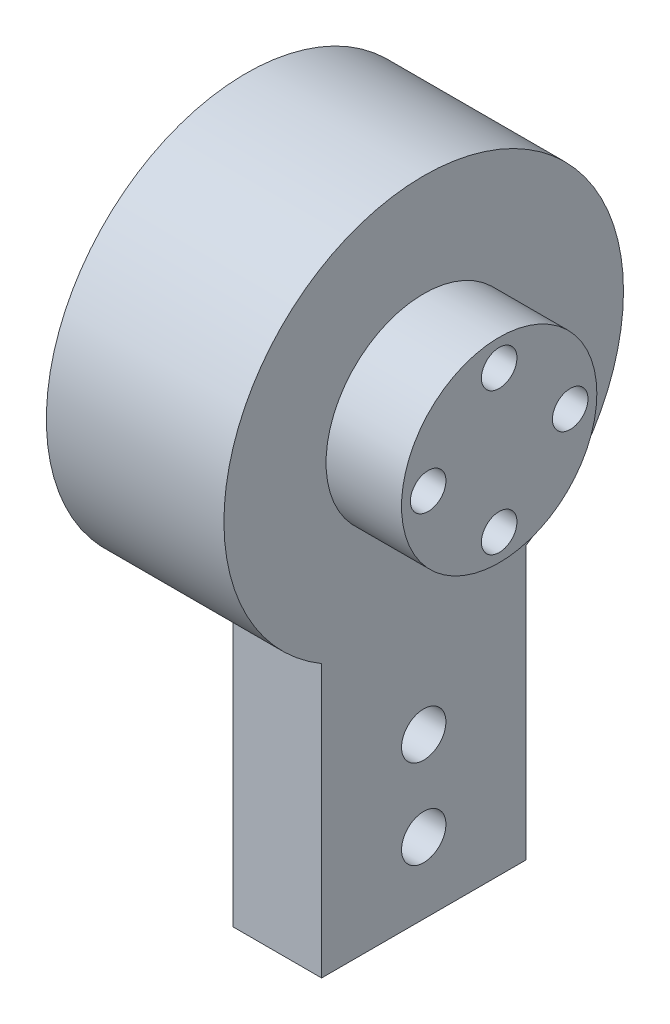
from build123d import *

# Parameters (mm, degrees)
SKETCH2_R            = 22.5
BOSS_EXTRUDE8_DEPTH  = 20
SKETCH2_10_R         = 11
BOSS_EXTRUDE9_DEPTH  = 8.5
BOSS_EXTRUDE10_REACH = 80.502
SKETCH8_W            = 10
SKETCH8_H            = 23
SKETCH9_R            = 2.5
CUT_EXTRUDE3_DEPTH   = 59.36308765
SKETCH10_R           = 4
CUT_EXTRUDE4_DEPTH   = 20
SKETCH11_R           = 2
CUT_EXTRUDE7_DEPTH   = 62.794012655


with BuildPart() as part:
    # Sketch2 → Boss-Extrude8 (new body)
    with BuildSketch(Plane(origin=(0, 0, 0), x_dir=(0, 0, -1), z_dir=(1, 0, 0))):
        Circle(SKETCH2_R)
    extrude(amount=-BOSS_EXTRUDE8_DEPTH)

    # Sketch8 → Boss-Extrude10 (add, up to next)
    with BuildSketch(Plane(origin=(0, -50, 0), x_dir=(1, 0, 0), z_dir=(0, 1, 0)), mode=Mode.PRIVATE) as boss_extrude10_sk1:
        with Locations((-5, 0)):
            Rectangle(SKETCH8_W, SKETCH8_H)
    boss_extrude10_tool1 = extrude(boss_extrude10_sk1.sketch, amount=BOSS_EXTRUDE10_REACH, mode=Mode.PRIVATE) - part.part
    add(boss_extrude10_tool1.solids().sort_by_distance((-5, -50, 0))[0])

    # Sketch9 → Cut-Extrude3 (cut, through all)
    with BuildSketch(Plane(origin=(0, 0, 0), x_dir=(0, 0, -1), z_dir=(1, 0, 0))):
        with Locations((0, -42)):
            Circle(SKETCH9_R)
        with Locations((0, -32)):
            Circle(SKETCH9_R)
    extrude(amount=-CUT_EXTRUDE3_DEPTH, mode=Mode.SUBTRACT)

    # Sketch10 → Cut-Extrude4 (cut)
    with BuildSketch(Plane.ZY.offset(20)):
        Circle(SKETCH10_R)
    extrude(amount=-CUT_EXTRUDE4_DEPTH, mode=Mode.SUBTRACT)


with BuildPart() as body_2:
    # Sketch2<10> → Boss-Extrude9 (new body)
    with BuildSketch(Plane(origin=(0, 0, 0), x_dir=(0, 0, -1), z_dir=(1, 0, 0))):
        Circle(SKETCH2_10_R)
    extrude(amount=BOSS_EXTRUDE9_DEPTH)


with BuildPart() as cut_extrude7_tool:
    # Sketch11 → Cut-Extrude7 (new, through all)
    with BuildSketch(Plane(origin=(8.5, 0, 0), x_dir=(0, 0, -1), z_dir=(1, 0, 0))):
        with Locations((0, 8)):
            Circle(SKETCH11_R)
        with Locations((8, 0)):
            Circle(SKETCH11_R)
        with Locations((0, -8)):
            Circle(SKETCH11_R)
        with Locations((-8, 0)):
            Circle(SKETCH11_R)
    extrude(amount=-CUT_EXTRUDE7_DEPTH)


with BuildPart() as part_1:
    add(part.part)

    # Cut-Extrude7: cut by cut_extrude7_tool
    add(cut_extrude7_tool.part, mode=Mode.SUBTRACT)


with BuildPart() as body_2_1:
    add(body_2.part)

    # Cut-Extrude7: cut by cut_extrude7_tool
    add(cut_extrude7_tool.part, mode=Mode.SUBTRACT)


solid = Compound([part_1.part, body_2_1.part])
